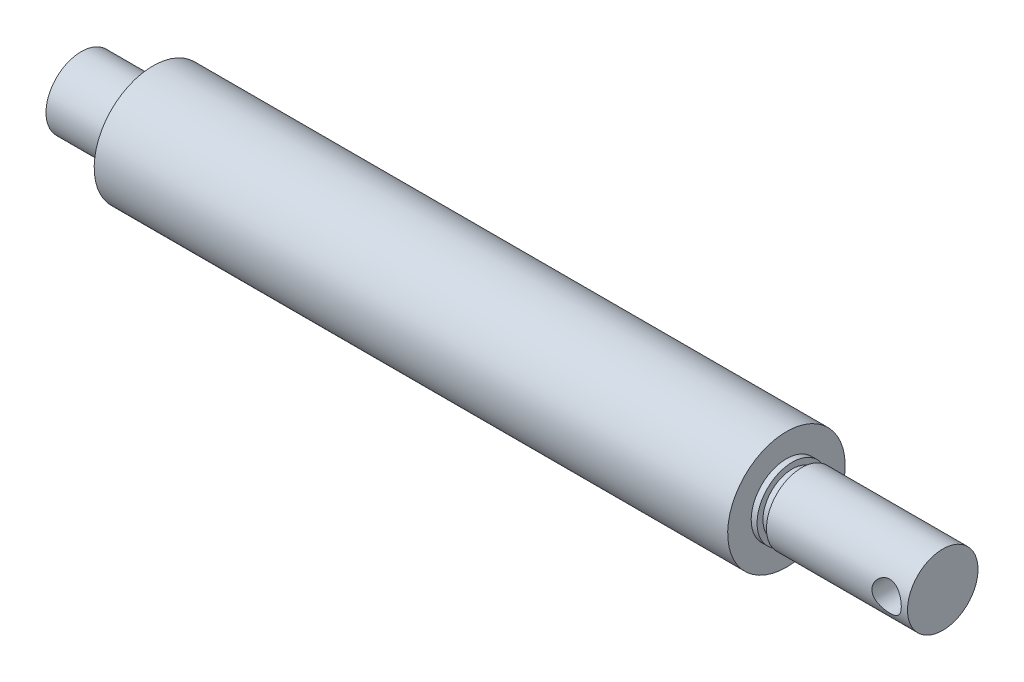
from build123d import *

# Parameters (mm, degrees)
SKETCH4_R          = 1.25
CUT_EXTRUDE1_DEPTH = 5


with BuildPart() as part:
    # Sketch1 → Revolve1 (revolve)
    with BuildSketch(Plane.XY, mode=Mode.PRIVATE) as revolve1_sk:
        Polygon((0, 0), (73.3, 0), (73.3, 3), (61.3, 3), (61.3, 2.5), (60.5, 2.5), (60.5, 3), (60, 3), (60, 5), (6.1, 5), (6.1, 3), (5.6, 3), (5.6, 2.5), (4.8, 2.5), (4.8, 3), (0, 3), align=None)
    revolve(revolve1_sk.sketch.rotate(Axis((0, 0, 0), (1, 0, 0)), 180), axis=Axis((0, 0, 0), (1, 0, 0)))

    # Sketch4 → Cut-Extrude1 (cut, symmetric)
    with BuildSketch(Plane(origin=(0, 0, 0), x_dir=(-1, 0, 0), z_dir=(0, 0, -1))):
        with Locations((-71.52, 0)):
            Circle(SKETCH4_R)
    extrude(amount=CUT_EXTRUDE1_DEPTH, both=True, mode=Mode.SUBTRACT)


solid = part.part
